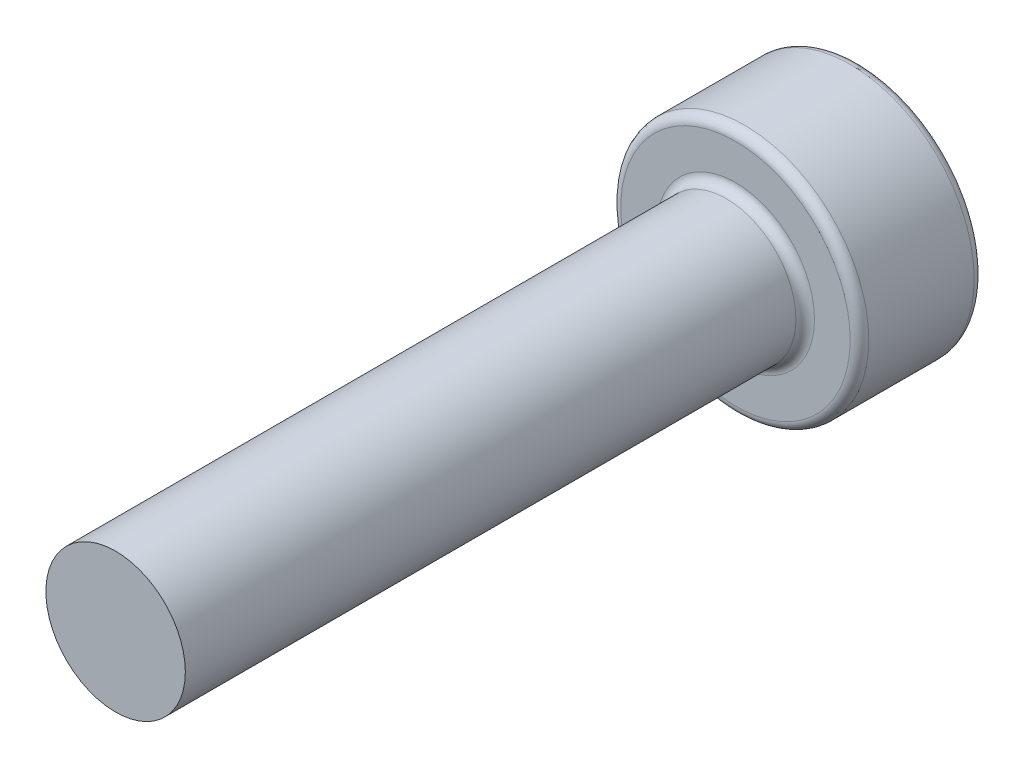
from build123d import *

# Parameters (mm, degrees)
SCHNITT_LINEAR_AUSTRAGEN1_DEPTH = 3
VERRUNDUNG1_R                   = 0.3
KREISMUSTER1_COUNT              = 2
KREISMUSTER1_ANGLE              = 90


with BuildPart() as part:
    # Skizze1 → Rotation1 (revolve)
    with BuildSketch(Plane(origin=(0, 0, 0), x_dir=(0, 0, -1), z_dir=(0, 1, 0))):
        Polygon((0, 0), (0, 24), (4, 24), (4, 20), (2.25, 20), (2.25, 0), align=None)
    revolve(axis=Axis((0, 0, 0), (-1, 0, 0)))

    # Skizze2 → Schnitt-Linear austragen1 (cut)
    with BuildSketch(Plane(origin=(-24, 0, 0), x_dir=(0, 1, 0), z_dir=(-1, 0, 0))):
        Polygon((0, 2.886751346), (-2.5, 1.443375673), (-2.5, -1.443375673), (0, -2.886751346), (2.5, -1.443375673), (2.5, 1.443375673), align=None)
    extrude(amount=-SCHNITT_LINEAR_AUSTRAGEN1_DEPTH, mode=Mode.SUBTRACT)

    # Verrundung1
    verrundung1_edges = [part.edges().sort_by_distance(p)[0] for p in [
        (-20, 0, 2.25),
        (-20, 0, 4),
        (-24, 0, 4),
    ]]
    fillet(verrundung1_edges, radius=VERRUNDUNG1_R)


with BuildPart() as kreismuster1_1:
    # Kreismuster1: pattern copy
    add(part.part.rotate(Axis((0, 0, 0), (0, -1, 0)), 1 * KREISMUSTER1_ANGLE / (KREISMUSTER1_COUNT - 1)))


solid = kreismuster1_1.part
